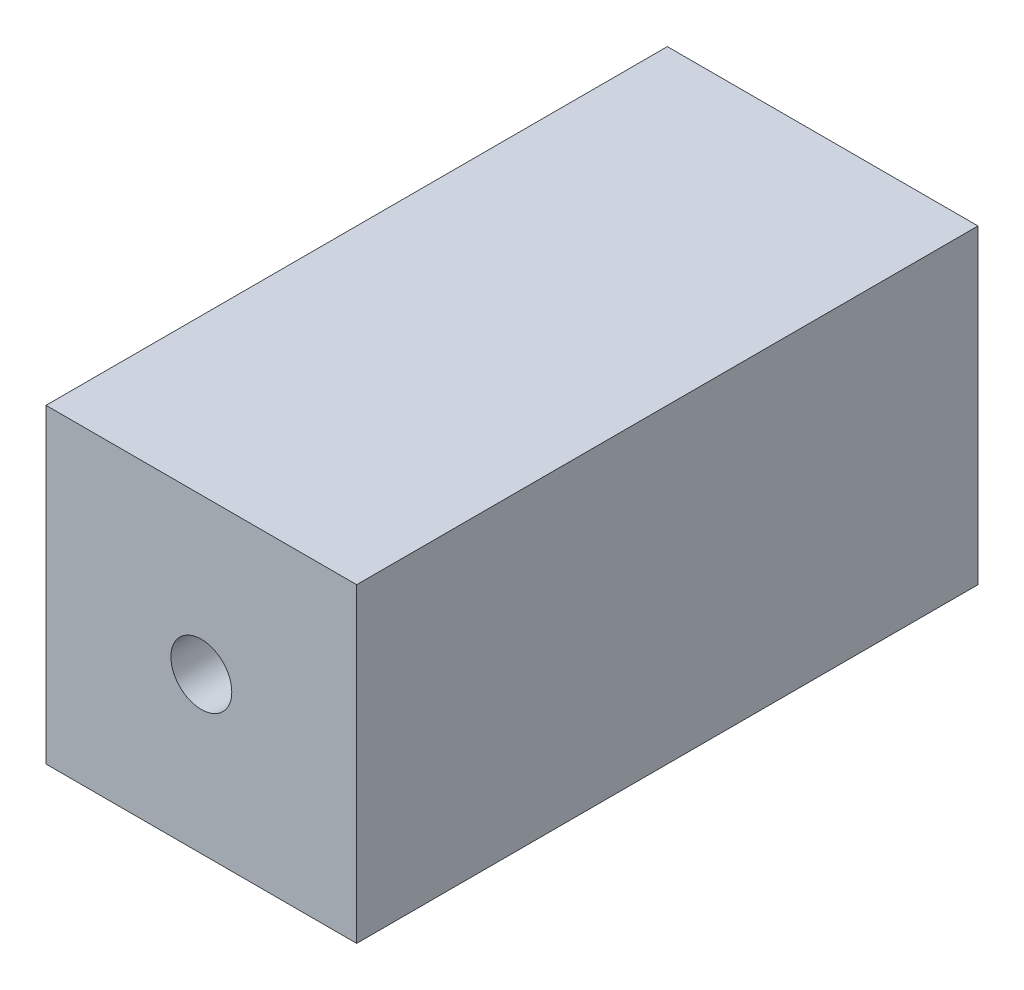
from build123d import *

# Parameters (mm, degrees)
SKETCH1_W           = 25.4
SKETCH1_H           = 25.4
BOSS_EXTRUDE1_DEPTH = 50.8
SKETCH2_R           = 2.4892
CUT_EXTRUDE1_DEPTH  = 63.217039467


with BuildPart() as part:
    # Sketch1 → Boss-Extrude1 (new body)
    with BuildSketch(Plane.XY):
        with Locations((12.7, 12.7)):
            Rectangle(SKETCH1_W, SKETCH1_H)
    extrude(amount=BOSS_EXTRUDE1_DEPTH)

    # Sketch2 → Cut-Extrude1 (cut, through all)
    with BuildSketch(Plane.XY.offset(50.8)):
        with Locations((12.7, 12.7)):
            Circle(SKETCH2_R)
    extrude(amount=-CUT_EXTRUDE1_DEPTH, mode=Mode.SUBTRACT)


solid = part.part
